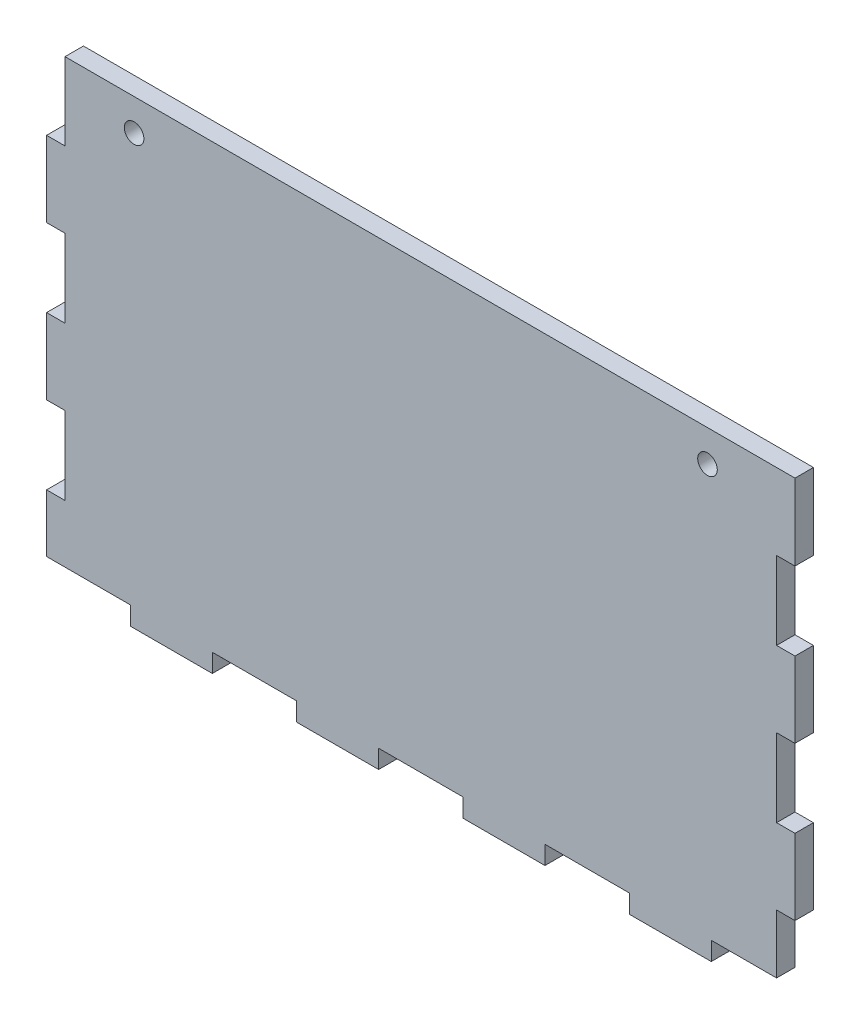
from build123d import *

# Parameters (mm, degrees)
SKETCH1_W           = 130
SKETCH1_H           = 80
BOSS_EXTRUDE1_DEPTH = 3.2
SKETCH2_W           = 14.444444444
SKETCH2_H           = 3.2
SKETCH2_W_2         = 3.2
SKETCH2_H_2         = 13.333333334
SKETCH2_H_3         = 13.333333333
CUT_EXTRUDE1_DEPTH  = 153.676913775
MOVE_FACE1_BY       = 0.1
MOVE_FACE1_2_BY     = 0.1
MOVE_FACE1_3_BY     = 0.1
MOVE_FACE1_4_BY     = 0.1
MOVE_FACE1_5_BY     = 0.1
MOVE_FACE1_6_BY     = 0.1
MOVE_FACE1_7_BY     = 0.1
MOVE_FACE1_8_BY     = 0.1
MOVE_FACE1_9_BY     = 0.1
MOVE_FACE1_10_BY    = 0.1
MOVE_FACE1_11_BY    = 0.1
MOVE_FACE1_12_BY    = 0.1
MOVE_FACE1_13_BY    = 0.1
MOVE_FACE1_14_BY    = 0.1
MOVE_FACE1_15_BY    = 0.1
MOVE_FACE1_16_BY    = 0.1
MOVE_FACE1_17_BY    = 0.1
MOVE_FACE1_18_BY    = 0.1
CUT_EXTRUDE2_REACH  = 154.677
SKETCH3_R           = 1.7


with BuildPart() as part:
    # Sketch1 → Boss-Extrude1 (new body)
    with BuildSketch(Plane.XY):
        with Locations((65, 40)):
            Rectangle(SKETCH1_W, SKETCH1_H)
    extrude(amount=BOSS_EXTRUDE1_DEPTH)

    # Sketch2 → Cut-Extrude1 (cut, through all)
    with BuildSketch(Plane.XY.offset(3.2)):
        with Locations((7.222222222, 1.6)):
            Rectangle(SKETCH2_W, SKETCH2_H)
        with Locations((36.111111111, 1.6)):
            Rectangle(SKETCH2_W, SKETCH2_H)
        with Locations((65, 1.6)):
            Rectangle(SKETCH2_W, SKETCH2_H)
        with Locations((93.888888889, 1.6)):
            Rectangle(SKETCH2_W, SKETCH2_H)
        Polygon((115.555555556, 0), (115.555555556, 3.2), (126.8, 3.2), (126.8, 13.333333333), (130, 13.333333333), (130, 0), align=None)
        with Locations((1.6, 20)):
            Rectangle(SKETCH2_W_2, SKETCH2_H_2)
        with Locations((1.6, 46.666666667)):
            Rectangle(SKETCH2_W_2, SKETCH2_H_3)
        with Locations((1.6, 73.333333334)):
            Rectangle(SKETCH2_W_2, SKETCH2_H_3)
        with Locations((128.4, 33.333333334)):
            Rectangle(SKETCH2_W_2, SKETCH2_H_3)
        with Locations((128.4, 60)):
            Rectangle(SKETCH2_W_2, SKETCH2_H_2)
    extrude(amount=-CUT_EXTRUDE1_DEPTH, mode=Mode.SUBTRACT)

    # Move Face1: a face moved inward by 0.1
    extrude(part.faces().sort_by_distance((128.4, 53.333333333, 1.6))[0], amount=MOVE_FACE1_BY, dir=(0, -1, 0), mode=Mode.SUBTRACT)

    # Move Face1 2: a face moved inward by 0.1
    extrude(part.faces().sort_by_distance((128.4, 26.666666667, 1.6))[0], amount=MOVE_FACE1_2_BY, dir=(0, -1, 0), mode=Mode.SUBTRACT)

    # Move Face1 3: a face moved inward by 0.1
    extrude(part.faces().sort_by_distance((128.4, 13.333333333, 1.6))[0], amount=MOVE_FACE1_3_BY, dir=(0, 1, 0), mode=Mode.SUBTRACT)

    # Move Face1 4: a face moved inward by 0.1
    extrude(part.faces().sort_by_distance((128.4, 40, 1.6))[0], amount=MOVE_FACE1_4_BY, dir=(0, 1, 0), mode=Mode.SUBTRACT)

    # Move Face1 5: a face moved inward by 0.1
    extrude(part.faces().sort_by_distance((128.4, 66.666666667, 1.6))[0], amount=MOVE_FACE1_5_BY, dir=(0, 1, 0), mode=Mode.SUBTRACT)

    # Move Face1 6: a face moved inward by 0.1
    extrude(part.faces().sort_by_distance((115.555555556, 1.6, 1.6))[0], amount=MOVE_FACE1_6_BY, dir=(-1, 0, 0), mode=Mode.SUBTRACT)

    # Move Face1 7: a face moved inward by 0.1
    extrude(part.faces().sort_by_distance((86.666666667, 1.6, 1.6))[0], amount=MOVE_FACE1_7_BY, dir=(-1, 0, 0), mode=Mode.SUBTRACT)

    # Move Face1 8: a face moved inward by 0.1
    extrude(part.faces().sort_by_distance((57.777777778, 1.6, 1.6))[0], amount=MOVE_FACE1_8_BY, dir=(-1, 0, 0), mode=Mode.SUBTRACT)

    # Move Face1 9: a face moved inward by 0.1
    extrude(part.faces().sort_by_distance((28.888888889, 1.6, 1.6))[0], amount=MOVE_FACE1_9_BY, dir=(-1, 0, 0), mode=Mode.SUBTRACT)

    # Move Face1 10: a face moved inward by 0.1
    extrude(part.faces().sort_by_distance((14.444444444, 1.6, 1.6))[0], amount=MOVE_FACE1_10_BY, dir=(1, 0, 0), mode=Mode.SUBTRACT)

    # Move Face1 11: a face moved inward by 0.1
    extrude(part.faces().sort_by_distance((43.333333333, 1.6, 1.6))[0], amount=MOVE_FACE1_11_BY, dir=(1, 0, 0), mode=Mode.SUBTRACT)

    # Move Face1 12: a face moved inward by 0.1
    extrude(part.faces().sort_by_distance((72.222222222, 1.6, 1.6))[0], amount=MOVE_FACE1_12_BY, dir=(1, 0, 0), mode=Mode.SUBTRACT)

    # Move Face1 13: a face moved inward by 0.1
    extrude(part.faces().sort_by_distance((101.111111111, 1.6, 1.6))[0], amount=MOVE_FACE1_13_BY, dir=(1, 0, 0), mode=Mode.SUBTRACT)

    # Move Face1 14: a face moved inward by 0.1
    extrude(part.faces().sort_by_distance((1.6, 26.666666667, 1.6))[0], amount=MOVE_FACE1_14_BY, dir=(0, 1, 0), mode=Mode.SUBTRACT)

    # Move Face1 15: a face moved inward by 0.1
    extrude(part.faces().sort_by_distance((1.6, 13.333333333, 1.6))[0], amount=MOVE_FACE1_15_BY, dir=(0, -1, 0), mode=Mode.SUBTRACT)

    # Move Face1 16: a face moved inward by 0.1
    extrude(part.faces().sort_by_distance((1.6, 40, 1.6))[0], amount=MOVE_FACE1_16_BY, dir=(0, -1, 0), mode=Mode.SUBTRACT)

    # Move Face1 17: a face moved inward by 0.1
    extrude(part.faces().sort_by_distance((1.6, 53.333333333, 1.6))[0], amount=MOVE_FACE1_17_BY, dir=(0, 1, 0), mode=Mode.SUBTRACT)

    # Move Face1 18: a face moved inward by 0.1
    extrude(part.faces().sort_by_distance((1.6, 66.666666667, 1.6))[0], amount=MOVE_FACE1_18_BY, dir=(0, -1, 0), mode=Mode.SUBTRACT)

    # Sketch3 → Cut-Extrude2 (cut, up to next)
    with BuildSketch(Plane.XY.offset(3.2), mode=Mode.PRIVATE) as cut_extrude2_sk1:
        with Locations((15.2, 74.5)):
            Circle(SKETCH3_R)
    cut_extrude2_tool1 = extrude(cut_extrude2_sk1.sketch, amount=-CUT_EXTRUDE2_REACH, mode=Mode.PRIVATE) & part.part
    # Sketch3 → Cut-Extrude2 (cut, up to next)
    with BuildSketch(Plane.XY.offset(3.2), mode=Mode.PRIVATE) as cut_extrude2_sk2:
        with Locations(Location((114.8, 74.5, 0), (0, 0, 180))):
            Circle(SKETCH3_R)
    cut_extrude2_tool2 = extrude(cut_extrude2_sk2.sketch, amount=-CUT_EXTRUDE2_REACH, mode=Mode.PRIVATE) & part.part
    add(cut_extrude2_tool1.solids().sort_by_distance((15.2, 74.5, 3.2))[0], mode=Mode.SUBTRACT)
    add(cut_extrude2_tool2.solids().sort_by_distance((114.8, 74.5, 3.2))[0], mode=Mode.SUBTRACT)


solid = part.part
